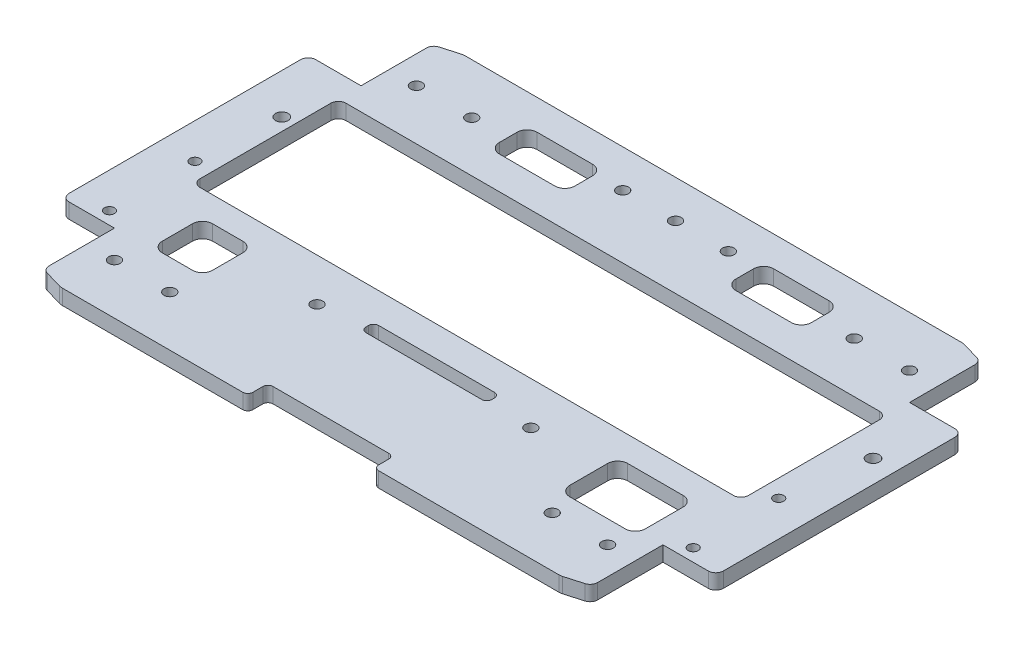
from build123d import *

# Parameters (mm, degrees)
BOSS_EXTRU_1_DEPTH         = 6
ENL_V_MAT_EXTRU_6_REACH    = 161.643
ESQUISSE15_R               = 2.3
ENL_V_MAT_EXTRU_10_REACH   = 161.643
SYM_TRIE8_COPY_1_REACH     = 161.643
ENL_V_MAT_EXTRU_12_REACH   = 161.643
ESQUISSE26_W               = 5
ESQUISSE26_H               = 98
ENL_V_MAT_EXTRU_13_REACH   = 154.761
ENL_V_MAT_EXTRU_14_REACH   = 154.761
ESQUISSE30_R               = 2.5
CONG_1_R                   = 3
CONG_2_R                   = 3
CONG_3_R                   = 5
ENL_V_MAT_EXTRU_15_REACH   = 154.761
ESQUISSE31_W               = 30
ESQUISSE31_H               = 23
ENL_V_MAT_EXTRU_16_REACH   = 154.761
ESQUISSE32_R               = 2.3
SYM_TRIE11_COPY_1_REACH    = 154.761
SYM_TRIE11_COPY_1_SKETCH_R = 2.3
ENL_V_MAT_EXTRU_17_REACH   = 154.761
ESQUISSE33_R               = 2
ENL_V_MAT_EXTRU_18_REACH   = 154.761
ESQUISSE34_R               = 2.3
CONG_4_R                   = 4
ENL_V_MAT_EXTRU_19_REACH   = 154.761
ESQUISSE35_W               = 20
ESQUISSE35_H               = 20
CONG_5_R                   = 4
ENL_V_MAT_EXTRU_20_REACH   = 154.761
CONG_6_R                   = 4
ESQUISSE37_R               = 2.3
ENL_V_MAT_EXTRU_21_DEPTH   = 153.761251631
ENL_V_MAT_EXTRU_22_REACH   = 154.761
CONG_7_R                   = 2


with BuildPart() as part:
    # Esquisse1 → Boss.-Extru.1 (new body)
    with BuildSketch(Plane(origin=(0, 0, 0), x_dir=(1, 0, 0), z_dir=(0, 1, 0))):
        Polygon((-135, 0), (-135, -75), (-100, -85), (0, -85), (100, -85), (135, -75), (135, 0), (135, 75), (100, 85), (0, 85), (-100, 85), (-135, 75), align=None)
    extrude(amount=BOSS_EXTRU_1_DEPTH)

    # Esquisse15 → Enlèv. mat.-Extru.6 (cut, up to next)
    with BuildSketch(Plane(origin=(0, 6, 0), x_dir=(1, 0, 0), z_dir=(0, 1, 0)), mode=Mode.PRIVATE) as enl_v_mat_extru_6_sk1:
        with Locations(Location((-120, -60, 0), (0, 0, 270))):
            Circle(ESQUISSE15_R)
    enl_v_mat_extru_6_tool1 = extrude(enl_v_mat_extru_6_sk1.sketch, amount=-ENL_V_MAT_EXTRU_6_REACH, mode=Mode.PRIVATE) & part.part
    # Esquisse15 → Enlèv. mat.-Extru.6 (cut, up to next)
    with BuildSketch(Plane(origin=(0, 6, 0), x_dir=(1, 0, 0), z_dir=(0, 1, 0)), mode=Mode.PRIVATE) as enl_v_mat_extru_6_sk2:
        with Locations(Location((-120, 60, 0), (0, 0, 270))):
            Circle(ESQUISSE15_R)
    enl_v_mat_extru_6_tool2 = extrude(enl_v_mat_extru_6_sk2.sketch, amount=-ENL_V_MAT_EXTRU_6_REACH, mode=Mode.PRIVATE) & part.part
    enl_v_mat_extru_6_1 = enl_v_mat_extru_6_tool1.solids().sort_by_distance((-120, 6, 60))[0]
    add(enl_v_mat_extru_6_1, mode=Mode.SUBTRACT)
    enl_v_mat_extru_6_2 = enl_v_mat_extru_6_tool2.solids().sort_by_distance((-120, 6, -60))[0]
    add(enl_v_mat_extru_6_2, mode=Mode.SUBTRACT)
    enl_v_mat_extru_6 = enl_v_mat_extru_6_1 + enl_v_mat_extru_6_2  # Enlèv. mat.-Extru.6 as one shape, for the pattern or mirror that repeats it

    # Symétrie5: Enlèv. mat.-Extru.6 across plane
    add(enl_v_mat_extru_6.mirror(Plane(origin=(0, 0, 0), x_dir=(0, 0, 1), z_dir=(1, 0, 0))), mode=Mode.SUBTRACT)

    # Esquisse20 → Enlèv. mat.-Extru.10 (cut, up to next)
    with BuildSketch(Plane(origin=(0, 6, 0), x_dir=(1, 0, 0), z_dir=(0, 1, 0)), mode=Mode.PRIVATE) as enl_v_mat_extru_10_sk1:
        Polygon((-109, -60), (-109, -82.428571429), (-135, -75), (-135, -49), (-109, -49), align=None)
    enl_v_mat_extru_10_tool1 = extrude(enl_v_mat_extru_10_sk1.sketch, amount=-ENL_V_MAT_EXTRU_10_REACH, mode=Mode.PRIVATE) & part.part
    enl_v_mat_extru_10 = enl_v_mat_extru_10_tool1.solids().sort_by_distance((-121.458333, 6, 63.934524))[0]
    add(enl_v_mat_extru_10, mode=Mode.SUBTRACT)

    # Symétrie7: Enlèv. mat.-Extru.10 across plane
    add(enl_v_mat_extru_10.mirror(Plane(origin=(0, 0, 0), x_dir=(0, 0, 1), z_dir=(1, 0, 0))), mode=Mode.SUBTRACT)

    # Symétrie8: Enlèv. mat.-Extru.10 across plane
    add(enl_v_mat_extru_10.mirror(Plane.XY), mode=Mode.SUBTRACT)

    # Symétrie8 copy 1 sketch → Symétrie8 copy 1 (cut, up to next)
    with BuildSketch(Plane(origin=(0, 6, 0), x_dir=(-1, 0, 0), z_dir=(0, 1, 0)), mode=Mode.PRIVATE) as sym_trie8_copy_1_sk1:
        Polygon((-109, -60), (-109, -82.428571429), (-135, -75), (-135, -49), (-109, -49), align=None)
    sym_trie8_copy_1_tool1 = extrude(sym_trie8_copy_1_sk1.sketch, amount=-SYM_TRIE8_COPY_1_REACH, mode=Mode.PRIVATE) & part.part
    add(sym_trie8_copy_1_tool1.solids().sort_by_distance((121.458333, 6, -63.934524))[0], mode=Mode.SUBTRACT)

    # Esquisse26 → Enlèv. mat.-Extru.12 (cut, up to next)
    with BuildSketch(Plane(origin=(0, 6, 0), x_dir=(1, 0, 0), z_dir=(0, 1, 0)), mode=Mode.PRIVATE) as enl_v_mat_extru_12_sk1:
        Polygon((-100, -80), (-99.299725277, -80), (-107.626394361, -77.62095169), (-109, -82.428571429), (-100, -85), align=None)
    enl_v_mat_extru_12_tool1 = extrude(enl_v_mat_extru_12_sk1.sketch, amount=-ENL_V_MAT_EXTRU_12_REACH, mode=Mode.PRIVATE) & part.part
    # Esquisse26 → Enlèv. mat.-Extru.12 (cut, up to next)
    with BuildSketch(Plane(origin=(0, 6, 0), x_dir=(1, 0, 0), z_dir=(0, 1, 0)), mode=Mode.PRIVATE) as enl_v_mat_extru_12_sk2:
        Polygon((-109, -82.428571429), (-107.626394361, -77.62095169), (-109, -77.228492936), align=None)
    enl_v_mat_extru_12_tool2 = extrude(enl_v_mat_extru_12_sk2.sketch, amount=-ENL_V_MAT_EXTRU_12_REACH, mode=Mode.PRIVATE) & part.part
    # Esquisse26 → Enlèv. mat.-Extru.12 (cut, up to next)
    with BuildSketch(Plane(origin=(0, 6, 0), x_dir=(1, 0, 0), z_dir=(0, 1, 0)), mode=Mode.PRIVATE) as enl_v_mat_extru_12_sk3:
        Polygon((98.626394361, -80.192380262), (99.299725277, -80), (-99.299725277, -80), (-98.626394361, -80.192380262), (-100, -85), (100, -85), align=None)
    enl_v_mat_extru_12_tool3 = extrude(enl_v_mat_extru_12_sk3.sketch, amount=-ENL_V_MAT_EXTRU_12_REACH, mode=Mode.PRIVATE) & part.part
    # Esquisse26 → Enlèv. mat.-Extru.12 (cut, up to next)
    with BuildSketch(Plane(origin=(0, 6, 0), x_dir=(1, 0, 0), z_dir=(0, 1, 0)), mode=Mode.PRIVATE) as enl_v_mat_extru_12_sk4:
        Polygon((109, -82.428571429), (107.626394361, -77.62095169), (99.299725277, -80), (100, -80), (100, -85), align=None)
    enl_v_mat_extru_12_tool4 = extrude(enl_v_mat_extru_12_sk4.sketch, amount=-ENL_V_MAT_EXTRU_12_REACH, mode=Mode.PRIVATE) & part.part
    # Esquisse26 → Enlèv. mat.-Extru.12 (cut, up to next)
    with BuildSketch(Plane(origin=(0, 6, 0), x_dir=(1, 0, 0), z_dir=(0, 1, 0)), mode=Mode.PRIVATE) as enl_v_mat_extru_12_sk5:
        Polygon((100, -80), (99.299725277, -80), (98.626394361, -80.192380262), (100, -85), align=None)
    enl_v_mat_extru_12_tool5 = extrude(enl_v_mat_extru_12_sk5.sketch, amount=-ENL_V_MAT_EXTRU_12_REACH, mode=Mode.PRIVATE) & part.part
    # Esquisse26 → Enlèv. mat.-Extru.12 (cut, up to next)
    with BuildSketch(Plane(origin=(0, 6, 0), x_dir=(1, 0, 0), z_dir=(0, 1, 0)), mode=Mode.PRIVATE) as enl_v_mat_extru_12_sk6:
        Polygon((109, -82.428571429), (109, -77.228492936), (107.626394361, -77.62095169), align=None)
    enl_v_mat_extru_12_tool6 = extrude(enl_v_mat_extru_12_sk6.sketch, amount=-ENL_V_MAT_EXTRU_12_REACH, mode=Mode.PRIVATE) & part.part
    # Esquisse26 → Enlèv. mat.-Extru.12 (cut, up to next)
    with BuildSketch(Plane(origin=(0, 6, 0), x_dir=(1, 0, 0), z_dir=(0, 1, 0)), mode=Mode.PRIVATE) as enl_v_mat_extru_12_sk7:
        with Locations((132.5, 0)):
            Rectangle(ESQUISSE26_W, ESQUISSE26_H)
    enl_v_mat_extru_12_tool7 = extrude(enl_v_mat_extru_12_sk7.sketch, amount=-ENL_V_MAT_EXTRU_12_REACH, mode=Mode.PRIVATE) & part.part
    # Esquisse26 → Enlèv. mat.-Extru.12 (cut, up to next)
    with BuildSketch(Plane(origin=(0, 6, 0), x_dir=(1, 0, 0), z_dir=(0, 1, 0)), mode=Mode.PRIVATE) as enl_v_mat_extru_12_sk8:
        Polygon((107.626394361, 77.62095169), (109, 82.428571429), (100, 85), (100, 80), (99.299725277, 80), align=None)
    enl_v_mat_extru_12_tool8 = extrude(enl_v_mat_extru_12_sk8.sketch, amount=-ENL_V_MAT_EXTRU_12_REACH, mode=Mode.PRIVATE) & part.part
    # Esquisse26 → Enlèv. mat.-Extru.12 (cut, up to next)
    with BuildSketch(Plane(origin=(0, 6, 0), x_dir=(1, 0, 0), z_dir=(0, 1, 0)), mode=Mode.PRIVATE) as enl_v_mat_extru_12_sk9:
        Polygon((107.626394361, 77.62095169), (109, 77.228492936), (109, 82.428571429), align=None)
    enl_v_mat_extru_12_tool9 = extrude(enl_v_mat_extru_12_sk9.sketch, amount=-ENL_V_MAT_EXTRU_12_REACH, mode=Mode.PRIVATE) & part.part
    # Esquisse26 → Enlèv. mat.-Extru.12 (cut, up to next)
    with BuildSketch(Plane(origin=(0, 6, 0), x_dir=(1, 0, 0), z_dir=(0, 1, 0)), mode=Mode.PRIVATE) as enl_v_mat_extru_12_sk10:
        Polygon((100, 80), (100, 85), (98.626394361, 80.192380262), (99.299725277, 80), align=None)
    enl_v_mat_extru_12_tool10 = extrude(enl_v_mat_extru_12_sk10.sketch, amount=-ENL_V_MAT_EXTRU_12_REACH, mode=Mode.PRIVATE) & part.part
    # Esquisse26 → Enlèv. mat.-Extru.12 (cut, up to next)
    with BuildSketch(Plane(origin=(0, 6, 0), x_dir=(1, 0, 0), z_dir=(0, 1, 0)), mode=Mode.PRIVATE) as enl_v_mat_extru_12_sk11:
        Polygon((98.626394361, 80.192380262), (100, 85), (-100, 85), (-98.626394361, 80.192380262), (-99.299725277, 80), (99.299725277, 80), align=None)
    enl_v_mat_extru_12_tool11 = extrude(enl_v_mat_extru_12_sk11.sketch, amount=-ENL_V_MAT_EXTRU_12_REACH, mode=Mode.PRIVATE) & part.part
    # Esquisse26 → Enlèv. mat.-Extru.12 (cut, up to next)
    with BuildSketch(Plane(origin=(0, 6, 0), x_dir=(1, 0, 0), z_dir=(0, 1, 0)), mode=Mode.PRIVATE) as enl_v_mat_extru_12_sk12:
        Polygon((-98.626394361, 80.192380262), (-100, 85), (-100, 80), (-99.299725277, 80), align=None)
    enl_v_mat_extru_12_tool12 = extrude(enl_v_mat_extru_12_sk12.sketch, amount=-ENL_V_MAT_EXTRU_12_REACH, mode=Mode.PRIVATE) & part.part
    # Esquisse26 → Enlèv. mat.-Extru.12 (cut, up to next)
    with BuildSketch(Plane(origin=(0, 6, 0), x_dir=(1, 0, 0), z_dir=(0, 1, 0)), mode=Mode.PRIVATE) as enl_v_mat_extru_12_sk13:
        Polygon((-100, 80), (-100, 85), (-109, 82.428571429), (-107.626394361, 77.62095169), (-99.299725277, 80), align=None)
    enl_v_mat_extru_12_tool13 = extrude(enl_v_mat_extru_12_sk13.sketch, amount=-ENL_V_MAT_EXTRU_12_REACH, mode=Mode.PRIVATE) & part.part
    # Esquisse26 → Enlèv. mat.-Extru.12 (cut, up to next)
    with BuildSketch(Plane(origin=(0, 6, 0), x_dir=(1, 0, 0), z_dir=(0, 1, 0)), mode=Mode.PRIVATE) as enl_v_mat_extru_12_sk14:
        Polygon((-107.626394361, 77.62095169), (-109, 82.428571429), (-109, 77.228492936), align=None)
    enl_v_mat_extru_12_tool14 = extrude(enl_v_mat_extru_12_sk14.sketch, amount=-ENL_V_MAT_EXTRU_12_REACH, mode=Mode.PRIVATE) & part.part
    # Esquisse26 → Enlèv. mat.-Extru.12 (cut, up to next)
    with BuildSketch(Plane(origin=(0, 6, 0), x_dir=(1, 0, 0), z_dir=(0, 1, 0)), mode=Mode.PRIVATE) as enl_v_mat_extru_12_sk15:
        with Locations((-132.5, 0)):
            Rectangle(ESQUISSE26_W, ESQUISSE26_H)
    enl_v_mat_extru_12_tool15 = extrude(enl_v_mat_extru_12_sk15.sketch, amount=-ENL_V_MAT_EXTRU_12_REACH, mode=Mode.PRIVATE) & part.part
    # Esquisse26 → Enlèv. mat.-Extru.12 (cut, up to next)
    with BuildSketch(Plane(origin=(0, 6, 0), x_dir=(1, 0, 0), z_dir=(0, 1, 0)), mode=Mode.PRIVATE) as enl_v_mat_extru_12_sk16:
        Polygon((-98.626394361, -80.192380262), (-99.299725277, -80), (-100, -80), (-100, -85), align=None)
    enl_v_mat_extru_12_tool16 = extrude(enl_v_mat_extru_12_sk16.sketch, amount=-ENL_V_MAT_EXTRU_12_REACH, mode=Mode.PRIVATE) & part.part
    add(enl_v_mat_extru_12_tool1.solids().sort_by_distance((-104.158937, 6, 81.27908))[0], mode=Mode.SUBTRACT)
    add(enl_v_mat_extru_12_tool2.solids().sort_by_distance((-108.542131, 6, 79.092672))[0], mode=Mode.SUBTRACT)
    add(enl_v_mat_extru_12_tool3.solids().sort_by_distance((0, 6, 82.505651))[0], mode=Mode.SUBTRACT)
    add(enl_v_mat_extru_12_tool4.solids().sort_by_distance((104.158937, 6, 81.27908))[0], mode=Mode.SUBTRACT)
    add(enl_v_mat_extru_12_tool5.solids().sort_by_distance((99.537641, 6, 81.69873))[0], mode=Mode.SUBTRACT)
    add(enl_v_mat_extru_12_tool6.solids().sort_by_distance((108.542131, 6, 79.092672))[0], mode=Mode.SUBTRACT)
    add(enl_v_mat_extru_12_tool7.solids().sort_by_distance((132.5, 6, 0))[0], mode=Mode.SUBTRACT)
    add(enl_v_mat_extru_12_tool8.solids().sort_by_distance((104.158937, 6, -81.27908))[0], mode=Mode.SUBTRACT)
    add(enl_v_mat_extru_12_tool9.solids().sort_by_distance((108.542131, 6, -79.092672))[0], mode=Mode.SUBTRACT)
    add(enl_v_mat_extru_12_tool10.solids().sort_by_distance((99.537641, 6, -81.69873))[0], mode=Mode.SUBTRACT)
    add(enl_v_mat_extru_12_tool11.solids().sort_by_distance((0, 6, -82.505651))[0], mode=Mode.SUBTRACT)
    add(enl_v_mat_extru_12_tool12.solids().sort_by_distance((-99.537641, 6, -81.69873))[0], mode=Mode.SUBTRACT)
    add(enl_v_mat_extru_12_tool13.solids().sort_by_distance((-104.158937, 6, -81.27908))[0], mode=Mode.SUBTRACT)
    add(enl_v_mat_extru_12_tool14.solids().sort_by_distance((-108.542131, 6, -79.092672))[0], mode=Mode.SUBTRACT)
    add(enl_v_mat_extru_12_tool15.solids().sort_by_distance((-132.5, 6, 0))[0], mode=Mode.SUBTRACT)
    add(enl_v_mat_extru_12_tool16.solids().sort_by_distance((-99.537641, 6, 81.69873))[0], mode=Mode.SUBTRACT)

    # Esquisse28 → Enlèv. mat.-Extru.13 (cut, up to next)
    with BuildSketch(Plane(origin=(0, 6, 0), x_dir=(1, 0, 0), z_dir=(0, 1, 0)), mode=Mode.PRIVATE) as enl_v_mat_extru_13_sk1:
        Polygon((0, 40), (109, 40), (109, -18), (0, -18), (-109, -18), (-109, 40), align=None)
    enl_v_mat_extru_13_tool1 = extrude(enl_v_mat_extru_13_sk1.sketch, amount=-ENL_V_MAT_EXTRU_13_REACH, mode=Mode.PRIVATE) & part.part
    add(enl_v_mat_extru_13_tool1.solids().sort_by_distance((0, 6, -11))[0], mode=Mode.SUBTRACT)

    # Esquisse30 → Enlèv. mat.-Extru.14 (cut, up to next)
    with BuildSketch(Plane(origin=(0, 6, 0), x_dir=(1, 0, 0), z_dir=(0, 1, 0)), mode=Mode.PRIVATE) as enl_v_mat_extru_14_sk1:
        with Locations(Location((-114, 22.5, 0), (0, 0, 270))):
            Circle(ESQUISSE30_R)
    enl_v_mat_extru_14_tool1 = extrude(enl_v_mat_extru_14_sk1.sketch, amount=-ENL_V_MAT_EXTRU_14_REACH, mode=Mode.PRIVATE) & part.part
    # Esquisse30 → Enlèv. mat.-Extru.14 (cut, up to next)
    with BuildSketch(Plane(origin=(0, 6, 0), x_dir=(1, 0, 0), z_dir=(0, 1, 0)), mode=Mode.PRIVATE) as enl_v_mat_extru_14_sk2:
        with Locations(Location((121, 22.5, 0), (0, 0, 270))):
            Circle(ESQUISSE30_R)
    enl_v_mat_extru_14_tool2 = extrude(enl_v_mat_extru_14_sk2.sketch, amount=-ENL_V_MAT_EXTRU_14_REACH, mode=Mode.PRIVATE) & part.part
    add(enl_v_mat_extru_14_tool1.solids().sort_by_distance((-114, 6, -22.5))[0], mode=Mode.SUBTRACT)
    add(enl_v_mat_extru_14_tool2.solids().sort_by_distance((121, 6, -22.5))[0], mode=Mode.SUBTRACT)

    # Congé1
    cong_1_edges = [part.edges().sort_by_distance(p)[0] for p in [
        (-109, 3, -40),
        (109, 3, -40),
        (109, 3, 18),
        (-109, 3, 18),
    ]]
    fillet(cong_1_edges, radius=CONG_1_R)

    # Congé2
    cong_2_edges = [part.edges().sort_by_distance(p)[0] for p in [
        (130, 3, -49),
        (130, 3, 49),
        (109, 3, -77.228492936),
        (-109, 3, -77.228492936),
        (-130, 3, 49),
        (-130, 3, -49),
        (-109, 3, 77.228492936),
        (109, 3, 77.228492936),
    ]]
    fillet(cong_2_edges, radius=CONG_2_R)

    # Congé3
    cong_3_edges = [part.edges().sort_by_distance(p)[0] for p in [
        (99.299725277, 3, -80),
        (-99.299725277, 3, -80),
        (-99.299725277, 3, 80),
        (99.299725277, 3, 80),
    ]]
    fillet(cong_3_edges, radius=CONG_3_R)

    # Esquisse31 → Enlèv. mat.-Extru.15 (cut, up to next)
    with BuildSketch(Plane(origin=(0, 6, 0), x_dir=(1, 0, 0), z_dir=(0, 1, 0)), mode=Mode.PRIVATE) as enl_v_mat_extru_15_sk1:
        with Locations((85, -39.5)):
            Rectangle(ESQUISSE31_W, ESQUISSE31_H)
    enl_v_mat_extru_15_tool1 = extrude(enl_v_mat_extru_15_sk1.sketch, amount=-ENL_V_MAT_EXTRU_15_REACH, mode=Mode.PRIVATE) & part.part
    add(enl_v_mat_extru_15_tool1.solids().sort_by_distance((85, 6, 39.5))[0], mode=Mode.SUBTRACT)

    # Esquisse32 → Enlèv. mat.-Extru.16 (cut, up to next)
    with BuildSketch(Plane(origin=(0, 6, 0), x_dir=(1, 0, 0), z_dir=(0, 1, 0)), mode=Mode.PRIVATE) as enl_v_mat_extru_16_sk1:
        with Locations(Location((98, -60, 0), (0, 0, 270))):
            Circle(ESQUISSE32_R)
    enl_v_mat_extru_16_tool1 = extrude(enl_v_mat_extru_16_sk1.sketch, amount=-ENL_V_MAT_EXTRU_16_REACH, mode=Mode.PRIVATE) & part.part
    # Esquisse32 → Enlèv. mat.-Extru.16 (cut, up to next)
    with BuildSketch(Plane(origin=(0, 6, 0), x_dir=(1, 0, 0), z_dir=(0, 1, 0)), mode=Mode.PRIVATE) as enl_v_mat_extru_16_sk2:
        with Locations(Location((76, -60, 0), (0, 0, 270))):
            Circle(ESQUISSE32_R)
    enl_v_mat_extru_16_tool2 = extrude(enl_v_mat_extru_16_sk2.sketch, amount=-ENL_V_MAT_EXTRU_16_REACH, mode=Mode.PRIVATE) & part.part
    enl_v_mat_extru_16_1 = enl_v_mat_extru_16_tool1.solids().sort_by_distance((98, 6, 60))[0]
    add(enl_v_mat_extru_16_1, mode=Mode.SUBTRACT)
    enl_v_mat_extru_16_2 = enl_v_mat_extru_16_tool2.solids().sort_by_distance((76, 6, 60))[0]
    add(enl_v_mat_extru_16_2, mode=Mode.SUBTRACT)
    enl_v_mat_extru_16 = enl_v_mat_extru_16_1 + enl_v_mat_extru_16_2  # Enlèv. mat.-Extru.16 as one shape, for the pattern or mirror that repeats it

    # Symétrie10: Enlèv. mat.-Extru.16 across plane
    add(enl_v_mat_extru_16.mirror(Plane.XY), mode=Mode.SUBTRACT)

    # Symétrie11: Enlèv. mat.-Extru.16 across plane
    add(enl_v_mat_extru_16.mirror(Plane(origin=(0, 0, 0), x_dir=(0, 0, 1), z_dir=(1, 0, 0))), mode=Mode.SUBTRACT)

    # Symétrie11 copy 1 sketch → Symétrie11 copy 1 (cut, up to next)
    with BuildSketch(Plane(origin=(0, 6, 0), x_dir=(-1, 0, 0), z_dir=(0, 1, 0)), mode=Mode.PRIVATE) as sym_trie11_copy_1_sk1:
        with Locations(Location((98, -60, 0), (0, 0, 270))):
            Circle(SYM_TRIE11_COPY_1_SKETCH_R)
    sym_trie11_copy_1_tool1 = extrude(sym_trie11_copy_1_sk1.sketch, amount=-SYM_TRIE11_COPY_1_REACH, mode=Mode.PRIVATE) & part.part
    # Symétrie11 copy 1 sketch → Symétrie11 copy 1 (cut, up to next)
    with BuildSketch(Plane(origin=(0, 6, 0), x_dir=(-1, 0, 0), z_dir=(0, 1, 0)), mode=Mode.PRIVATE) as sym_trie11_copy_1_sk2:
        with Locations(Location((76, -60, 0), (0, 0, 270))):
            Circle(SYM_TRIE11_COPY_1_SKETCH_R)
    sym_trie11_copy_1_tool2 = extrude(sym_trie11_copy_1_sk2.sketch, amount=-SYM_TRIE11_COPY_1_REACH, mode=Mode.PRIVATE) & part.part
    add(sym_trie11_copy_1_tool1.solids().sort_by_distance((-98, 6, -60))[0], mode=Mode.SUBTRACT)
    add(sym_trie11_copy_1_tool2.solids().sort_by_distance((-76, 6, -60))[0], mode=Mode.SUBTRACT)

    # Esquisse33 → Enlèv. mat.-Extru.17 (cut, up to next)
    with BuildSketch(Plane(origin=(0, 6, 0), x_dir=(1, 0, 0), z_dir=(0, 1, 0)), mode=Mode.PRIVATE) as enl_v_mat_extru_17_sk1:
        with Locations(Location((-116, -44, 0), (0, 0, 270))):
            Circle(ESQUISSE33_R)
    enl_v_mat_extru_17_tool1 = extrude(enl_v_mat_extru_17_sk1.sketch, amount=-ENL_V_MAT_EXTRU_17_REACH, mode=Mode.PRIVATE) & part.part
    # Esquisse33 → Enlèv. mat.-Extru.17 (cut, up to next)
    with BuildSketch(Plane(origin=(0, 6, 0), x_dir=(1, 0, 0), z_dir=(0, 1, 0)), mode=Mode.PRIVATE) as enl_v_mat_extru_17_sk2:
        with Locations(Location((-116, -10, 0), (0, 0, 270))):
            Circle(ESQUISSE33_R)
    enl_v_mat_extru_17_tool2 = extrude(enl_v_mat_extru_17_sk2.sketch, amount=-ENL_V_MAT_EXTRU_17_REACH, mode=Mode.PRIVATE) & part.part
    enl_v_mat_extru_17_1 = enl_v_mat_extru_17_tool1.solids().sort_by_distance((-116, 6, 44))[0]
    add(enl_v_mat_extru_17_1, mode=Mode.SUBTRACT)
    enl_v_mat_extru_17_2 = enl_v_mat_extru_17_tool2.solids().sort_by_distance((-116, 6, 10))[0]
    add(enl_v_mat_extru_17_2, mode=Mode.SUBTRACT)
    enl_v_mat_extru_17 = enl_v_mat_extru_17_1 + enl_v_mat_extru_17_2  # Enlèv. mat.-Extru.17 as one shape, for the pattern or mirror that repeats it

    # Symétrie12: Enlèv. mat.-Extru.17 across plane
    add(enl_v_mat_extru_17.mirror(Plane(origin=(0, 0, 0), x_dir=(0, 0, 1), z_dir=(1, 0, 0))), mode=Mode.SUBTRACT)

    # Esquisse34 → Enlèv. mat.-Extru.18 (cut, up to next)
    with BuildSketch(Plane(origin=(0, 6, 0), x_dir=(1, 0, 0), z_dir=(0, 1, 0)), mode=Mode.PRIVATE) as enl_v_mat_extru_18_sk1:
        with Locations(Location((21, 65, 0), (0, 0, 270))):
            Circle(ESQUISSE34_R)
    enl_v_mat_extru_18_tool1 = extrude(enl_v_mat_extru_18_sk1.sketch, amount=-ENL_V_MAT_EXTRU_18_REACH, mode=Mode.PRIVATE) & part.part
    # Esquisse34 → Enlèv. mat.-Extru.18 (cut, up to next)
    with BuildSketch(Plane(origin=(0, 6, 0), x_dir=(1, 0, 0), z_dir=(0, 1, 0)), mode=Mode.PRIVATE) as enl_v_mat_extru_18_sk2:
        with Locations(Location((-21, 65, 0), (0, 0, 270))):
            Circle(ESQUISSE34_R)
    enl_v_mat_extru_18_tool2 = extrude(enl_v_mat_extru_18_sk2.sketch, amount=-ENL_V_MAT_EXTRU_18_REACH, mode=Mode.PRIVATE) & part.part
    # Esquisse34 → Enlèv. mat.-Extru.18 (cut, up to next)
    with BuildSketch(Plane(origin=(0, 6, 0), x_dir=(1, 0, 0), z_dir=(0, 1, 0)), mode=Mode.PRIVATE) as enl_v_mat_extru_18_sk3:
        with Locations(Location((0, 65, 0), (0, 0, 270))):
            Circle(ESQUISSE34_R)
    enl_v_mat_extru_18_tool3 = extrude(enl_v_mat_extru_18_sk3.sketch, amount=-ENL_V_MAT_EXTRU_18_REACH, mode=Mode.PRIVATE) & part.part
    add(enl_v_mat_extru_18_tool1.solids().sort_by_distance((21, 6, -65))[0], mode=Mode.SUBTRACT)
    add(enl_v_mat_extru_18_tool2.solids().sort_by_distance((-21, 6, -65))[0], mode=Mode.SUBTRACT)
    add(enl_v_mat_extru_18_tool3.solids().sort_by_distance((0, 6, -65))[0], mode=Mode.SUBTRACT)

    # Congé4
    cong_4_edges = [part.edges().sort_by_distance(p)[0] for p in [
        (70, 3, 51),
        (70, 3, 28),
        (100, 3, 28),
        (100, 3, 51),
    ]]
    fillet(cong_4_edges, radius=CONG_4_R)

    # Esquisse35 → Enlèv. mat.-Extru.19 (cut, up to next)
    with BuildSketch(Plane(origin=(0, 6, 0), x_dir=(1, 0, 0), z_dir=(0, 1, 0)), mode=Mode.PRIVATE) as enl_v_mat_extru_19_sk1:
        with Locations((-85, -38)):
            Rectangle(ESQUISSE35_W, ESQUISSE35_H)
    enl_v_mat_extru_19_tool1 = extrude(enl_v_mat_extru_19_sk1.sketch, amount=-ENL_V_MAT_EXTRU_19_REACH, mode=Mode.PRIVATE) & part.part
    add(enl_v_mat_extru_19_tool1.solids().sort_by_distance((-85, 6, 38))[0], mode=Mode.SUBTRACT)

    # Congé5
    cong_5_edges = [part.edges().sort_by_distance(p)[0] for p in [
        (-75, 3, 28),
        (-75, 3, 48),
        (-95, 3, 48),
        (-95, 3, 28),
    ]]
    fillet(cong_5_edges, radius=CONG_5_R)

    # Esquisse36 → Enlèv. mat.-Extru.20 (cut, up to next)
    with BuildSketch(Plane(origin=(0, 6, 0), x_dir=(1, 0, 0), z_dir=(0, 1, 0)), mode=Mode.PRIVATE) as enl_v_mat_extru_20_sk1:
        Polygon((-50, 68), (-32, 68), (-32, 53), (-62, 53), (-62, 68), align=None)
    enl_v_mat_extru_20_tool1 = extrude(enl_v_mat_extru_20_sk1.sketch, amount=-ENL_V_MAT_EXTRU_20_REACH, mode=Mode.PRIVATE) & part.part
    # Esquisse36 → Enlèv. mat.-Extru.20 (cut, up to next)
    with BuildSketch(Plane(origin=(0, 6, 0), x_dir=(1, 0, 0), z_dir=(0, 1, 0)), mode=Mode.PRIVATE) as enl_v_mat_extru_20_sk2:
        Polygon((62, 68), (50, 68), (32, 68), (32, 53), (62, 53), align=None)
    enl_v_mat_extru_20_tool2 = extrude(enl_v_mat_extru_20_sk2.sketch, amount=-ENL_V_MAT_EXTRU_20_REACH, mode=Mode.PRIVATE) & part.part
    add(enl_v_mat_extru_20_tool1.solids().sort_by_distance((-47, 6, -60.5))[0], mode=Mode.SUBTRACT)
    add(enl_v_mat_extru_20_tool2.solids().sort_by_distance((47, 6, -60.5))[0], mode=Mode.SUBTRACT)

    # Congé6
    cong_6_edges = [part.edges().sort_by_distance(p)[0] for p in [
        (-62, 3, -53),
        (-62, 3, -68),
        (-32, 3, -68),
        (-32, 3, -53),
        (32, 3, -68),
        (62, 3, -68),
        (62, 3, -53),
        (32, 3, -53),
    ]]
    fillet(cong_6_edges, radius=CONG_6_R)

    # Esquisse37 → Enlèv. mat.-Extru.21 (cut, through all)
    with BuildSketch(Plane(origin=(0, 6, 0), x_dir=(1, 0, 0), z_dir=(0, 1, 0))):
        with Locations(Location((-42.5, -35, 0), (0, 0, 270))):
            Circle(ESQUISSE37_R)
        with Locations(Location((42.5, -35, 0), (0, 0, 270))):
            Circle(ESQUISSE37_R)
    extrude(amount=-ENL_V_MAT_EXTRU_21_DEPTH, mode=Mode.SUBTRACT)

    # Esquisse38 → Enlèv. mat.-Extru.22 (cut, up to next)
    with BuildSketch(Plane(origin=(0, 6, 0), x_dir=(1, 0, 0), z_dir=(0, 1, 0)), mode=Mode.PRIVATE) as enl_v_mat_extru_22_sk1:
        Polygon((0, -35), (25, -35), (25, -30), (-25, -30), (-25, -35), align=None)
    enl_v_mat_extru_22_tool1 = extrude(enl_v_mat_extru_22_sk1.sketch, amount=-ENL_V_MAT_EXTRU_22_REACH, mode=Mode.PRIVATE) & part.part
    # Esquisse38 → Enlèv. mat.-Extru.22 (cut, up to next)
    with BuildSketch(Plane(origin=(0, 6, 0), x_dir=(1, 0, 0), z_dir=(0, 1, 0)), mode=Mode.PRIVATE) as enl_v_mat_extru_22_sk2:
        Polygon((0, -72), (25, -72), (25, -80), (-25, -80), (-25, -72), align=None)
    enl_v_mat_extru_22_tool2 = extrude(enl_v_mat_extru_22_sk2.sketch, amount=-ENL_V_MAT_EXTRU_22_REACH, mode=Mode.PRIVATE) & part.part
    add(enl_v_mat_extru_22_tool1.solids().sort_by_distance((0, 6, 32.5))[0], mode=Mode.SUBTRACT)
    add(enl_v_mat_extru_22_tool2.solids().sort_by_distance((0, 6, 76))[0], mode=Mode.SUBTRACT)

    # Congé7
    cong_7_edges = [part.edges().sort_by_distance(p)[0] for p in [
        (-25, 3, 72),
        (25, 3, 72),
        (25, 3, 80),
        (-25, 3, 80),
        (-25, 3, 35),
        (-25, 3, 30),
        (25, 3, 30),
        (25, 3, 35),
    ]]
    fillet(cong_7_edges, radius=CONG_7_R)


solid = part.part
